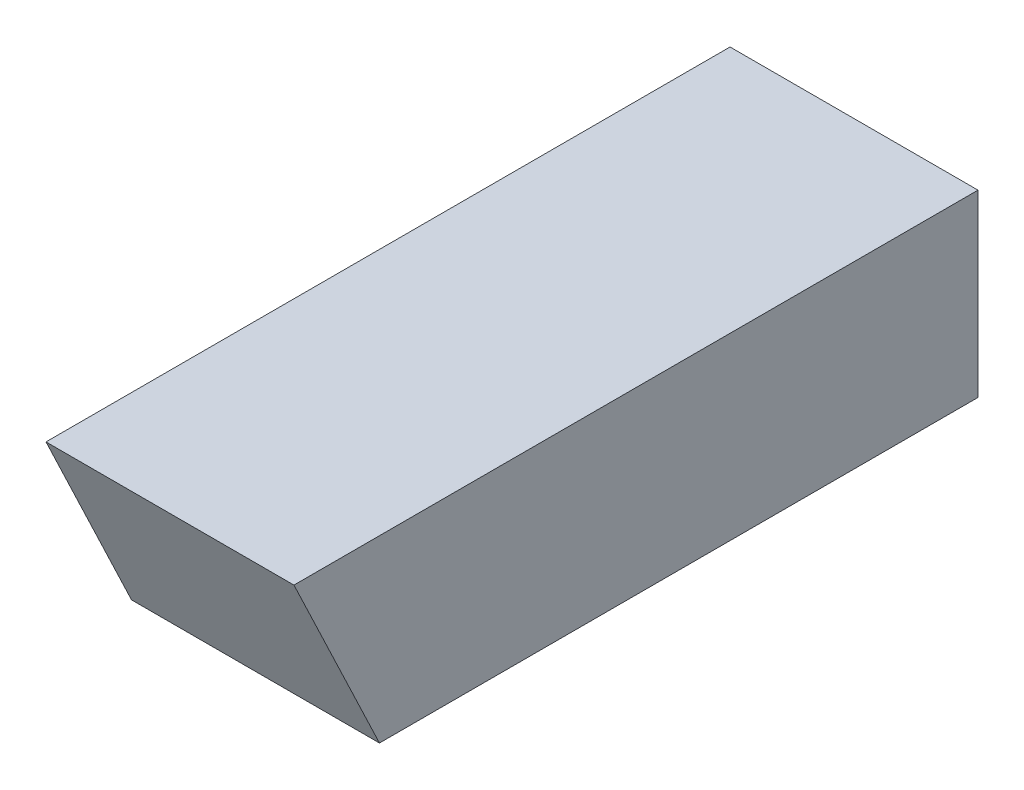
from build123d import *

# Parameters (mm, degrees)
BOSS_EXTRUDE1_DEPTH             = 145
TAP_DRILL_FOR_1_4_20_TAP1_D     = 5.1054
TAP_DRILL_FOR_1_4_20_TAP1_DEPTH = 8
TAP_DRILL_FOR_1_4_20_TAP1_TIP   = 1.533816902
SKETCH4_W                       = 55
SKETCH4_H                       = 30
BOSS_EXTRUDE2_DEPTH             = 30


with BuildPart() as part:
    # Sketch1 → Boss-Extrude1 (new body)
    with BuildSketch(Plane(origin=(0, 0, 0), x_dir=(0, 0, -1), z_dir=(1, 0, 0))):
        Polygon((-350, 0), (0, 0), (0, 105), (-400, 105), align=None)
    extrude(amount=BOSS_EXTRUDE1_DEPTH)

    # Tap Drill for 1/4-20 Tap1
    with Locations(Plane(origin=(0, 0, 0), x_dir=(-1, 0, 0), z_dir=(0, -1, 0))):
        with Locations((-72.5, -253), (-72.5, -203), (-72.5, -153)):
            Hole(TAP_DRILL_FOR_1_4_20_TAP1_D / 2, depth=TAP_DRILL_FOR_1_4_20_TAP1_DEPTH)
            with Locations((0, 0, -(TAP_DRILL_FOR_1_4_20_TAP1_DEPTH + TAP_DRILL_FOR_1_4_20_TAP1_TIP / 2))):  # 118° drill point
                Cone(0, TAP_DRILL_FOR_1_4_20_TAP1_D / 2, TAP_DRILL_FOR_1_4_20_TAP1_TIP, mode=Mode.SUBTRACT)

    # Sketch4 → Boss-Extrude2 (add)
    with BuildSketch(Plane.XZ):
        with Locations((72.5, 98)):
            Rectangle(SKETCH4_W, SKETCH4_H)
    extrude(amount=BOSS_EXTRUDE2_DEPTH)


solid = part.part
